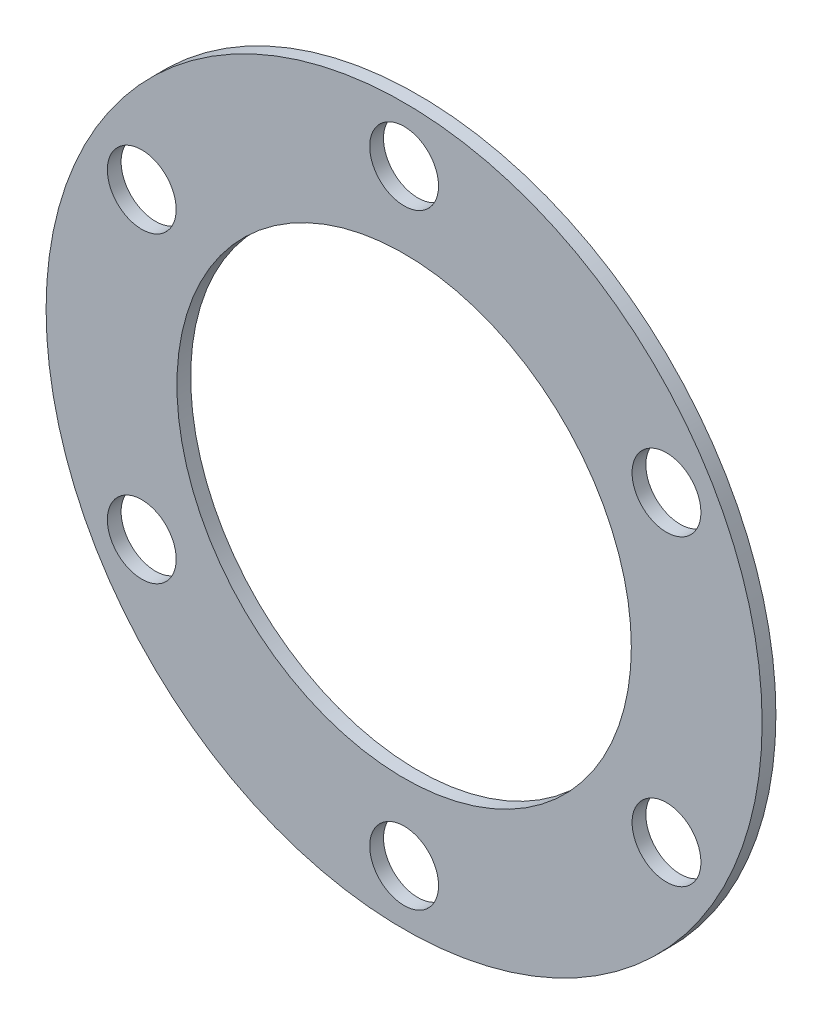
from build123d import *

# Parameters (mm, degrees)
ESQUISSE1_R        = 26
ESQUISSE1_R_2      = 2.5
ESQUISSE1_R_3      = 16.5
BOSS_EXTRU_1_DEPTH = 1


with BuildPart() as part:
    # Esquisse1 → Boss.-Extru.1 (new body)
    with BuildSketch(Plane.XY):
        Circle(ESQUISSE1_R)
        with Locations((0, 22)):
            Circle(ESQUISSE1_R_2, mode=Mode.SUBTRACT)
        with Locations((19.053058883, 11.000866025)):
            Circle(ESQUISSE1_R_2, mode=Mode.SUBTRACT)
        with Locations((19.054058883, -10.999133975)):
            Circle(ESQUISSE1_R_2, mode=Mode.SUBTRACT)
        with Locations((0.002, -22)):
            Circle(ESQUISSE1_R_2, mode=Mode.SUBTRACT)
        with Locations((-19.051058883, -11.000866025)):
            Circle(ESQUISSE1_R_2, mode=Mode.SUBTRACT)
        with Locations((-19.052058883, 10.999133975)):
            Circle(ESQUISSE1_R_2, mode=Mode.SUBTRACT)
        Circle(ESQUISSE1_R_3, mode=Mode.SUBTRACT)
    extrude(amount=BOSS_EXTRU_1_DEPTH)


solid = part.part
